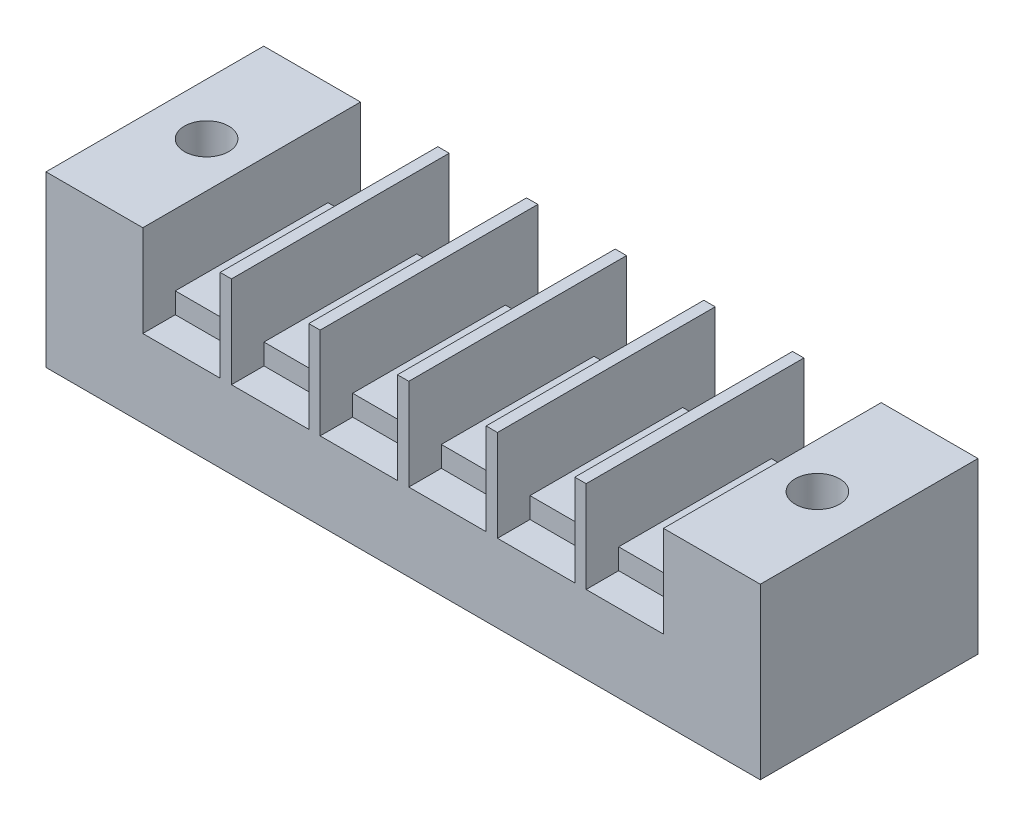
from build123d import *

# Parameters (mm, degrees)
SKETCH_1_W                        = 72.5
SKETCH_1_H                        = 22.1
SKETCH_1_R                        = 2.25
EXTRUDE_1_DEPTH                   = 17.2
SKETCH_2_W                        = 7.85
SKETCH_2_H                        = 22.1
CUT_EXTRUDE_1_DEPTH               = 7.2
SKETCH_3_W                        = 7.85
SKETCH_3_H                        = 3.3
CUT_EXTRUDE_2_DEPTH               = 2.1
SKETCH_4_R                        = 1.75
CUT_EXTRUDE_3_DEPTH               = 5
PATTERN_LINEAR_1_COUNT            = 6
PATTERN_LINEAR_1_PITCH            = 9
PATTERN_LINEAR_1_COPY_1_SKETCH_W  = 7.85
PATTERN_LINEAR_1_COPY_1_SKETCH_H  = 3.3
PATTERN_LINEAR_1_COPY_1_DEPTH     = 2.1
PATTERN_LINEAR_1_COPY_2_SKETCH_W  = 7.85
PATTERN_LINEAR_1_COPY_2_SKETCH_H  = 3.3
PATTERN_LINEAR_1_COPY_2_DEPTH     = 2.1
PATTERN_LINEAR_1_COPY_3_SKETCH_W  = 7.85
PATTERN_LINEAR_1_COPY_3_SKETCH_H  = 3.3
PATTERN_LINEAR_1_COPY_3_DEPTH     = 2.1
PATTERN_LINEAR_1_COPY_4_SKETCH_W  = 7.85
PATTERN_LINEAR_1_COPY_4_SKETCH_H  = 3.3
PATTERN_LINEAR_1_COPY_4_DEPTH     = 2.1
PATTERN_LINEAR_1_COPY_5_SKETCH_W  = 7.85
PATTERN_LINEAR_1_COPY_5_SKETCH_H  = 3.3
PATTERN_LINEAR_1_COPY_5_DEPTH     = 2.1
PATTERN_LINEAR_1_COPY_6_SKETCH_R  = 1.75
PATTERN_LINEAR_1_COPY_6_DEPTH     = 5
PATTERN_LINEAR_1_COPY_7_SKETCH_R  = 1.75
PATTERN_LINEAR_1_COPY_7_DEPTH     = 5
PATTERN_LINEAR_1_COPY_8_SKETCH_R  = 1.75
PATTERN_LINEAR_1_COPY_8_DEPTH     = 5
PATTERN_LINEAR_1_COPY_9_SKETCH_R  = 1.75
PATTERN_LINEAR_1_COPY_9_DEPTH     = 5
PATTERN_LINEAR_1_COPY_10_SKETCH_R = 1.75
PATTERN_LINEAR_1_COPY_10_DEPTH    = 5


with BuildPart() as part:
    # ｽｹｯﾁ1 → ﾎﾞｽ - 押し出し1 (new body)
    with BuildSketch(Plane(origin=(0, 0, 0), x_dir=(1, 0, 0), z_dir=(0, 1, 0))):
        Rectangle(SKETCH_1_W, SKETCH_1_H)
        with Locations(Location((31, 0, 0), (0, 0, 90))):
            Circle(SKETCH_1_R, mode=Mode.SUBTRACT)
        with Locations(Location((-31, 0, 0), (0, 0, 90))):
            Circle(SKETCH_1_R, mode=Mode.SUBTRACT)
    extrude(amount=EXTRUDE_1_DEPTH)

    # ｽｹｯﾁ2 → ｶｯﾄ - 押し出し1 (cut)
    with BuildSketch(Plane(origin=(0, 17.2, 0), x_dir=(1, 0, 0), z_dir=(0, 1, 0))):
        with Locations((22.5, 0)):
            Rectangle(SKETCH_2_W, SKETCH_2_H)
    cut_extrude_1 = extrude(amount=-CUT_EXTRUDE_1_DEPTH, mode=Mode.SUBTRACT)

    # ｽｹｯﾁ3 → ｶｯﾄ - 押し出し2 (cut)
    with BuildSketch(Plane(origin=(0, 10, 0), x_dir=(1, 0, 0), z_dir=(0, 1, 0))):
        with Locations((22.5, 9.4)):
            Rectangle(SKETCH_3_W, SKETCH_3_H)
    cut_extrude_2 = extrude(amount=-CUT_EXTRUDE_2_DEPTH, mode=Mode.SUBTRACT)

    # ｽｹｯﾁ4 → ｶｯﾄ - 押し出し3 (cut)
    with BuildSketch(Plane(origin=(0, 10, 0), x_dir=(1, 0, 0), z_dir=(0, 1, 0))):
        with Locations(Location((22.5, 4, 0), (0, 0, 270))):
            Circle(SKETCH_4_R)
    cut_extrude_3 = extrude(amount=-CUT_EXTRUDE_3_DEPTH, mode=Mode.SUBTRACT)

    # ﾐﾗｰ1: ｶｯﾄ - 押し出し2, ｶｯﾄ - 押し出し3 across plane
    add(cut_extrude_2.mirror(Plane.XY), mode=Mode.SUBTRACT)
    add(cut_extrude_3.mirror(Plane.XY), mode=Mode.SUBTRACT)

    # 直線ﾊﾟﾀｰﾝ1: ｶｯﾄ - 押し出し1, ｶｯﾄ - 押し出し2, ｶｯﾄ - 押し出し3 ×6
    with Locations(*[(-i * PATTERN_LINEAR_1_PITCH, 0, 0) for i in range(1, PATTERN_LINEAR_1_COUNT)]):
        add(cut_extrude_1, mode=Mode.SUBTRACT)
        add(cut_extrude_2, mode=Mode.SUBTRACT)
        add(cut_extrude_3, mode=Mode.SUBTRACT)

    # 直線ﾊﾟﾀｰﾝ1 copy 1 sketch → 直線ﾊﾟﾀｰﾝ1 copy 1 (cut)
    with BuildSketch(Plane(origin=(-9, 10, 0), x_dir=(1, 0, 0), z_dir=(0, 1, 0))):
        with Locations((22.5, -9.4)):
            Rectangle(PATTERN_LINEAR_1_COPY_1_SKETCH_W, PATTERN_LINEAR_1_COPY_1_SKETCH_H)
    extrude(amount=-PATTERN_LINEAR_1_COPY_1_DEPTH, mode=Mode.SUBTRACT)

    # 直線ﾊﾟﾀｰﾝ1 copy 2 sketch → 直線ﾊﾟﾀｰﾝ1 copy 2 (cut)
    with BuildSketch(Plane(origin=(-18, 10, 0), x_dir=(1, 0, 0), z_dir=(0, 1, 0))):
        with Locations((22.5, -9.4)):
            Rectangle(PATTERN_LINEAR_1_COPY_2_SKETCH_W, PATTERN_LINEAR_1_COPY_2_SKETCH_H)
    extrude(amount=-PATTERN_LINEAR_1_COPY_2_DEPTH, mode=Mode.SUBTRACT)

    # 直線ﾊﾟﾀｰﾝ1 copy 3 sketch → 直線ﾊﾟﾀｰﾝ1 copy 3 (cut)
    with BuildSketch(Plane(origin=(-27, 10, 0), x_dir=(1, 0, 0), z_dir=(0, 1, 0))):
        with Locations((22.5, -9.4)):
            Rectangle(PATTERN_LINEAR_1_COPY_3_SKETCH_W, PATTERN_LINEAR_1_COPY_3_SKETCH_H)
    extrude(amount=-PATTERN_LINEAR_1_COPY_3_DEPTH, mode=Mode.SUBTRACT)

    # 直線ﾊﾟﾀｰﾝ1 copy 4 sketch → 直線ﾊﾟﾀｰﾝ1 copy 4 (cut)
    with BuildSketch(Plane(origin=(-36, 10, 0), x_dir=(1, 0, 0), z_dir=(0, 1, 0))):
        with Locations((22.5, -9.4)):
            Rectangle(PATTERN_LINEAR_1_COPY_4_SKETCH_W, PATTERN_LINEAR_1_COPY_4_SKETCH_H)
    extrude(amount=-PATTERN_LINEAR_1_COPY_4_DEPTH, mode=Mode.SUBTRACT)

    # 直線ﾊﾟﾀｰﾝ1 copy 5 sketch → 直線ﾊﾟﾀｰﾝ1 copy 5 (cut)
    with BuildSketch(Plane(origin=(-45, 10, 0), x_dir=(1, 0, 0), z_dir=(0, 1, 0))):
        with Locations((22.5, -9.4)):
            Rectangle(PATTERN_LINEAR_1_COPY_5_SKETCH_W, PATTERN_LINEAR_1_COPY_5_SKETCH_H)
    extrude(amount=-PATTERN_LINEAR_1_COPY_5_DEPTH, mode=Mode.SUBTRACT)

    # 直線ﾊﾟﾀｰﾝ1 copy 6 sketch → 直線ﾊﾟﾀｰﾝ1 copy 6 (cut)
    with BuildSketch(Plane(origin=(-9, 10, 0), x_dir=(1, 0, 0), z_dir=(0, 1, 0))):
        with Locations((22.5, -4)):
            Circle(PATTERN_LINEAR_1_COPY_6_SKETCH_R)
    extrude(amount=-PATTERN_LINEAR_1_COPY_6_DEPTH, mode=Mode.SUBTRACT)

    # 直線ﾊﾟﾀｰﾝ1 copy 7 sketch → 直線ﾊﾟﾀｰﾝ1 copy 7 (cut)
    with BuildSketch(Plane(origin=(-18, 10, 0), x_dir=(1, 0, 0), z_dir=(0, 1, 0))):
        with Locations((22.5, -4)):
            Circle(PATTERN_LINEAR_1_COPY_7_SKETCH_R)
    extrude(amount=-PATTERN_LINEAR_1_COPY_7_DEPTH, mode=Mode.SUBTRACT)

    # 直線ﾊﾟﾀｰﾝ1 copy 8 sketch → 直線ﾊﾟﾀｰﾝ1 copy 8 (cut)
    with BuildSketch(Plane(origin=(-27, 10, 0), x_dir=(1, 0, 0), z_dir=(0, 1, 0))):
        with Locations((22.5, -4)):
            Circle(PATTERN_LINEAR_1_COPY_8_SKETCH_R)
    extrude(amount=-PATTERN_LINEAR_1_COPY_8_DEPTH, mode=Mode.SUBTRACT)

    # 直線ﾊﾟﾀｰﾝ1 copy 9 sketch → 直線ﾊﾟﾀｰﾝ1 copy 9 (cut)
    with BuildSketch(Plane(origin=(-36, 10, 0), x_dir=(1, 0, 0), z_dir=(0, 1, 0))):
        with Locations((22.5, -4)):
            Circle(PATTERN_LINEAR_1_COPY_9_SKETCH_R)
    extrude(amount=-PATTERN_LINEAR_1_COPY_9_DEPTH, mode=Mode.SUBTRACT)

    # 直線ﾊﾟﾀｰﾝ1 copy 10 sketch → 直線ﾊﾟﾀｰﾝ1 copy 10 (cut)
    with BuildSketch(Plane(origin=(-45, 10, 0), x_dir=(1, 0, 0), z_dir=(0, 1, 0))):
        with Locations((22.5, -4)):
            Circle(PATTERN_LINEAR_1_COPY_10_SKETCH_R)
    extrude(amount=-PATTERN_LINEAR_1_COPY_10_DEPTH, mode=Mode.SUBTRACT)


solid = part.part
